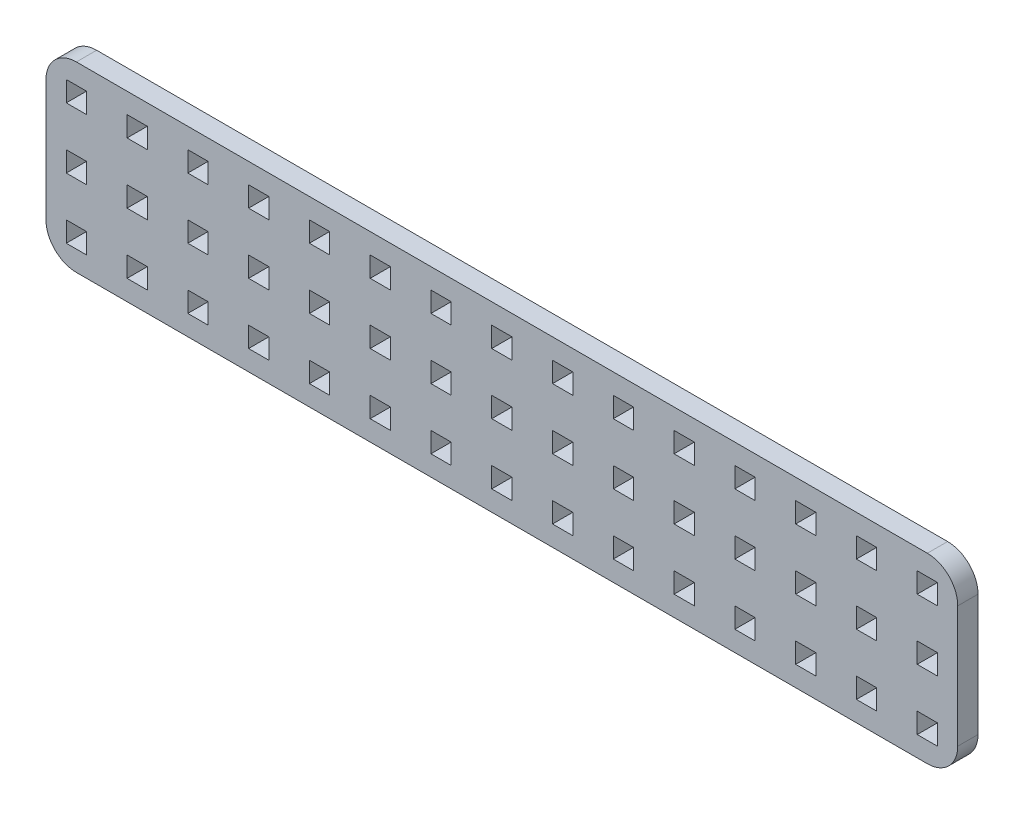
from build123d import *

# Parameters (mm, degrees)
MODEL_W                 = 3
MODEL_H                 = 3
SALIENTE_EXTRUIR1_DEPTH = 3


with BuildPart() as part:
    # Model → Saliente-Extruir1 (new body)
    with BuildSketch(Plane.XY):
        with BuildLine():
            Line((139.892723231, 274.571078663), (139.892723231, 292.568350817))
            ThreePointArc((139.892723231, 292.568350817), (138.574703747, 295.750331332), (135.392723231, 297.068350817))
            Line((135.392723231, 297.068350817), (9.392723231, 297.068350817))
            ThreePointArc((9.392723231, 297.068350817), (6.210742716, 295.750331332), (4.892723231, 292.568350817))
            Line((4.892723231, 292.568350817), (4.892723231, 274.571078663))
            ThreePointArc((4.892723231, 274.571078663), (6.210742716, 271.389098148), (9.392723231, 270.071078663))
            Line((9.392723231, 270.071078663), (135.392723231, 270.071078663))
            ThreePointArc((135.392723231, 270.071078663), (138.574703747, 271.389098148), (139.892723231, 274.571078663))
        make_face()
        with Locations((9.392723231, 292.568350816)):
            Rectangle(MODEL_W, MODEL_H, mode=Mode.SUBTRACT)
        with Locations((18.392723231, 292.568350816)):
            Rectangle(MODEL_W, MODEL_H, mode=Mode.SUBTRACT)
        with Locations((27.392723231, 292.568350816)):
            Rectangle(MODEL_W, MODEL_H, mode=Mode.SUBTRACT)
        with Locations((36.392723231, 292.568350816)):
            Rectangle(MODEL_W, MODEL_H, mode=Mode.SUBTRACT)
        with Locations((45.392723231, 292.568350816)):
            Rectangle(MODEL_W, MODEL_H, mode=Mode.SUBTRACT)
        with Locations((54.392723231, 292.568350816)):
            Rectangle(MODEL_W, MODEL_H, mode=Mode.SUBTRACT)
        with Locations((63.392723231, 292.568350816)):
            Rectangle(MODEL_W, MODEL_H, mode=Mode.SUBTRACT)
        with Locations((72.392723231, 292.568350816)):
            Rectangle(MODEL_W, MODEL_H, mode=Mode.SUBTRACT)
        with Locations((81.392723231, 292.568350816)):
            Rectangle(MODEL_W, MODEL_H, mode=Mode.SUBTRACT)
        with Locations((90.392723231, 292.568350816)):
            Rectangle(MODEL_W, MODEL_H, mode=Mode.SUBTRACT)
        with Locations((99.392723231, 292.568350816)):
            Rectangle(MODEL_W, MODEL_H, mode=Mode.SUBTRACT)
        with Locations((108.392723231, 292.568350816)):
            Rectangle(MODEL_W, MODEL_H, mode=Mode.SUBTRACT)
        with Locations((117.392723231, 292.568350816)):
            Rectangle(MODEL_W, MODEL_H, mode=Mode.SUBTRACT)
        with Locations((126.392723231, 292.568350816)):
            Rectangle(MODEL_W, MODEL_H, mode=Mode.SUBTRACT)
        with Locations((135.392723231, 292.568350816)):
            Rectangle(MODEL_W, MODEL_H, mode=Mode.SUBTRACT)
        with Locations((9.392723231, 283.568350816)):
            Rectangle(MODEL_W, MODEL_H, mode=Mode.SUBTRACT)
        with Locations((18.392723231, 283.568350816)):
            Rectangle(MODEL_W, MODEL_H, mode=Mode.SUBTRACT)
        with Locations((27.392723231, 283.568350816)):
            Rectangle(MODEL_W, MODEL_H, mode=Mode.SUBTRACT)
        with Locations((36.392723231, 283.568350816)):
            Rectangle(MODEL_W, MODEL_H, mode=Mode.SUBTRACT)
        with Locations((45.392723231, 283.568350816)):
            Rectangle(MODEL_W, MODEL_H, mode=Mode.SUBTRACT)
        with Locations((54.392723231, 283.568350816)):
            Rectangle(MODEL_W, MODEL_H, mode=Mode.SUBTRACT)
        with Locations((63.392723231, 283.568350816)):
            Rectangle(MODEL_W, MODEL_H, mode=Mode.SUBTRACT)
        with Locations((72.392723231, 283.568350816)):
            Rectangle(MODEL_W, MODEL_H, mode=Mode.SUBTRACT)
        with Locations((81.392723231, 283.568350816)):
            Rectangle(MODEL_W, MODEL_H, mode=Mode.SUBTRACT)
        with Locations((90.392723231, 283.568350816)):
            Rectangle(MODEL_W, MODEL_H, mode=Mode.SUBTRACT)
        with Locations((99.392723231, 283.568350816)):
            Rectangle(MODEL_W, MODEL_H, mode=Mode.SUBTRACT)
        with Locations((108.392723231, 283.568350816)):
            Rectangle(MODEL_W, MODEL_H, mode=Mode.SUBTRACT)
        with Locations((117.392723231, 283.568350816)):
            Rectangle(MODEL_W, MODEL_H, mode=Mode.SUBTRACT)
        with Locations((126.392723231, 283.568350816)):
            Rectangle(MODEL_W, MODEL_H, mode=Mode.SUBTRACT)
        with Locations((135.392723231, 283.568350816)):
            Rectangle(MODEL_W, MODEL_H, mode=Mode.SUBTRACT)
        with Locations((9.392723231, 274.568350816)):
            Rectangle(MODEL_W, MODEL_H, mode=Mode.SUBTRACT)
        with Locations((18.392723231, 274.568350816)):
            Rectangle(MODEL_W, MODEL_H, mode=Mode.SUBTRACT)
        with Locations((27.392723231, 274.568350816)):
            Rectangle(MODEL_W, MODEL_H, mode=Mode.SUBTRACT)
        with Locations((36.392723231, 274.568350816)):
            Rectangle(MODEL_W, MODEL_H, mode=Mode.SUBTRACT)
        with Locations((45.392723231, 274.568350816)):
            Rectangle(MODEL_W, MODEL_H, mode=Mode.SUBTRACT)
        with Locations((54.392723231, 274.568350816)):
            Rectangle(MODEL_W, MODEL_H, mode=Mode.SUBTRACT)
        with Locations((63.392723231, 274.568350816)):
            Rectangle(MODEL_W, MODEL_H, mode=Mode.SUBTRACT)
        with Locations((72.392723231, 274.568350816)):
            Rectangle(MODEL_W, MODEL_H, mode=Mode.SUBTRACT)
        with Locations((81.392723231, 274.568350816)):
            Rectangle(MODEL_W, MODEL_H, mode=Mode.SUBTRACT)
        with Locations((90.392723231, 274.568350816)):
            Rectangle(MODEL_W, MODEL_H, mode=Mode.SUBTRACT)
        with Locations((99.392723231, 274.568350816)):
            Rectangle(MODEL_W, MODEL_H, mode=Mode.SUBTRACT)
        with Locations((108.392723231, 274.568350816)):
            Rectangle(MODEL_W, MODEL_H, mode=Mode.SUBTRACT)
        with Locations((117.392723231, 274.568350816)):
            Rectangle(MODEL_W, MODEL_H, mode=Mode.SUBTRACT)
        with Locations((126.392723231, 274.568350816)):
            Rectangle(MODEL_W, MODEL_H, mode=Mode.SUBTRACT)
        with Locations((135.392723231, 274.568350816)):
            Rectangle(MODEL_W, MODEL_H, mode=Mode.SUBTRACT)
    extrude(amount=SALIENTE_EXTRUIR1_DEPTH)


solid = part.part
